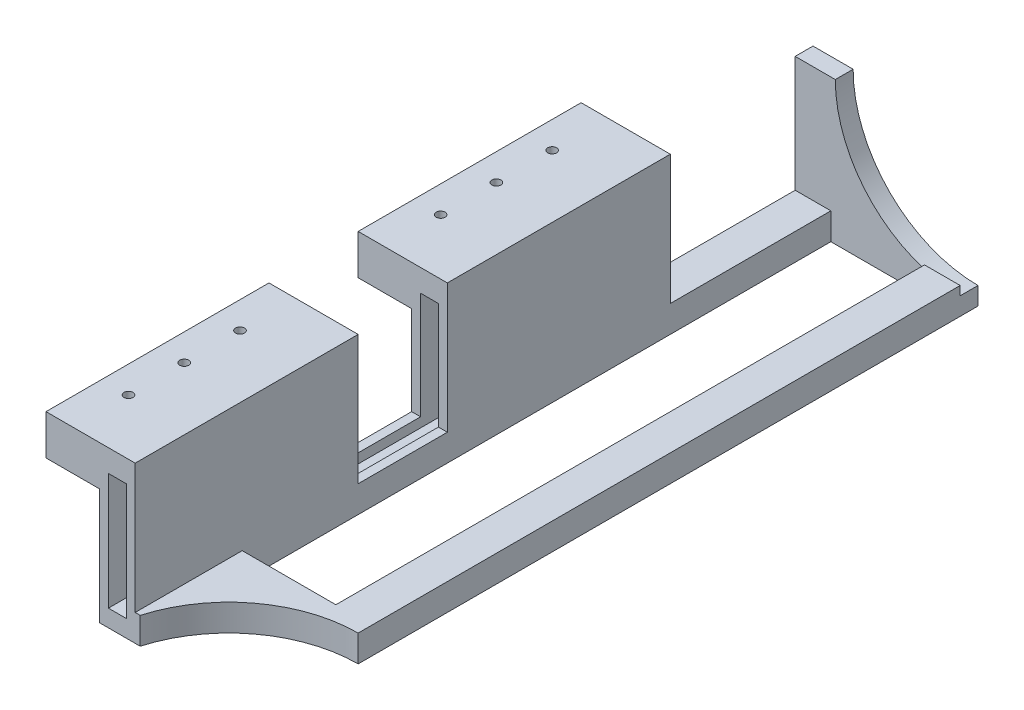
from build123d import *

# Parameters (mm, degrees)
SALIENTE_EXTRUIR1_DEPTH = 82
CROQUIS3_W              = 10
CROQUIS3_H              = 25
SALIENTE_EXTRUIR2_DEPTH = 1.5
CROQUIS4_W              = 18.5
CROQUIS4_H              = 16
SALIENTE_EXTRUIR3_DEPTH = 2
CROQUIS5_R              = 14.5
CORTAR_EXTRUIR1_DEPTH   = 10
CROQUIS9_R              = 0.5
CORTAR_EXTRUIR5_DEPTH   = 10
CORTAR_EXTRUIR6_DEPTH   = 2
CROQUIS11_W             = 10
CROQUIS11_H             = 13
CROQUIS11_W_2           = 18
CROQUIS11_W_3           = 8.121089167
CROQUIS11_H_2           = 20.058238939
CORTAR_EXTRUIR7_DEPTH   = 10
CROQUIS12_W             = 2
CROQUIS12_H             = 13.081043671
CORTAR_EXTRUIR8_DEPTH   = 60
CROQUIS13_W             = 10.5
CROQUIS13_H             = 66
CORTAR_EXTRUIR9_DEPTH   = 12
CROQUIS14_W             = 6
CROQUIS14_H             = 25
SALIENTE_EXTRUIR4_DEPTH = 3
CROQUIS15_R             = 0.5
CORTAR_EXTRUIR10_DEPTH  = 81.950919234


with BuildPart() as part:
    # Croquis2 → Saliente-Extruir1 (new body)
    with BuildSketch(Plane.XY):
        Polygon((-4.596277774, 11.502403514), (-4.596277774, -1.497596486), (9.903722226, -1.497596486), (9.903722226, -4.497596486), (-4.596277774, -4.497596486), (-8.596277774, -4.497596486), (-8.596277774, 11.502403514), align=None)
    extrude(amount=SALIENTE_EXTRUIR1_DEPTH)

    # Croquis3 → Saliente-Extruir2 (add)
    with BuildSketch(Plane(origin=(0, 11.502403514, 0), x_dir=(1, 0, 0), z_dir=(0, 1, 0))):
        with Locations((-9.596277774, -30.5)):
            Rectangle(CROQUIS3_W, CROQUIS3_H)
        with Locations((-9.596277774, -65.5)):
            Rectangle(CROQUIS3_W, CROQUIS3_H)
    extrude(amount=SALIENTE_EXTRUIR2_DEPTH)

    # Croquis4 → Saliente-Extruir3 (add)
    with BuildSketch(Plane(origin=(0, 0, 0), x_dir=(-1, 0, 0), z_dir=(0, 0, -1))):
        with Locations((-0.653722226, 3.502403514)):
            Rectangle(CROQUIS4_W, CROQUIS4_H)
    extrude(amount=SALIENTE_EXTRUIR3_DEPTH)

    # Croquis5 → Cortar-Extruir1 (cut)
    with BuildSketch(Plane(origin=(0, -1.497596486, 0), x_dir=(1, 0, 0), z_dir=(0, 1, 0))):
        with Locations((9.903722226, -82)):
            Circle(CROQUIS5_R)
    extrude(amount=-CORTAR_EXTRUIR1_DEPTH, mode=Mode.SUBTRACT)

    # Croquis9 → Cortar-Extruir5 (cut)
    with BuildSketch(Plane.XZ.offset(-11.502403514)):
        with Locations(Location((-11.596277774, 65.5, 0), (0, 0, 270))):
            Circle(CROQUIS9_R)
        with Locations(Location((-11.596277774, 59.25, 0), (0, 0, 270))):
            Circle(CROQUIS9_R)
        with Locations(Location((-11.596277774, 71.75, 0), (0, 0, 270))):
            Circle(CROQUIS9_R)
    cortar_extruir5 = extrude(amount=-CORTAR_EXTRUIR5_DEPTH, mode=Mode.SUBTRACT)

    # Simetría1: Cortar-Extruir5 across plane
    add(cortar_extruir5.mirror(Plane(origin=(0, 0, 48), x_dir=(1, 0, 0), z_dir=(0, 0, -1))), mode=Mode.SUBTRACT)

    # Croquis10 → Cortar-Extruir6 (cut)
    with BuildSketch(Plane(origin=(0, 0, -2), x_dir=(-1, 0, 0), z_dir=(0, 0, -1))):
        with BuildLine():
            Line((-9.903722226, -2.497596486), (-9.903722226, 11.502403514))
            Line((-9.903722226, 11.502403514), (4.096277774, 11.502403514))
            ThreePointArc((4.096277774, 11.502403514), (-0.00422729, 1.602908577), (-9.903722226, -2.497596486))
        make_face()
    extrude(amount=-CORTAR_EXTRUIR6_DEPTH, mode=Mode.SUBTRACT)

    # Croquis11 → Cortar-Extruir7 (cut)
    with BuildSketch(Plane.ZY.offset(8.596277774)):
        with Locations((48, 5.002403514)):
            Rectangle(CROQUIS11_W, CROQUIS11_H)
        with Locations((9, 5.002403514)):
            Rectangle(CROQUIS11_W_2, CROQUIS11_H)
        with Locations((82.060544584, 1.473284045)):
            Rectangle(CROQUIS11_W_3, CROQUIS11_H_2)
    extrude(amount=-CORTAR_EXTRUIR7_DEPTH, mode=Mode.SUBTRACT)

    # Croquis12 → Cortar-Extruir8 (cut)
    with BuildSketch(Plane.XY.offset(78)):
        with Locations((-6.596277774, 3.961881679)):
            Rectangle(CROQUIS12_W, CROQUIS12_H)
    extrude(amount=-CORTAR_EXTRUIR8_DEPTH, mode=Mode.SUBTRACT)

    # Croquis13 → Cortar-Extruir9 (cut)
    with BuildSketch(Plane.XZ.offset(4.497596486)):
        with Locations((0.653722226, 33)):
            Rectangle(CROQUIS13_W, CROQUIS13_H)
    extrude(amount=-CORTAR_EXTRUIR9_DEPTH, mode=Mode.SUBTRACT)

    # Croquis14 → Saliente-Extruir4 (add)
    with BuildSketch(Plane.XZ.offset(-11.502403514)):
        with Locations((-11.596277774, 65.5)):
            Rectangle(CROQUIS14_W, CROQUIS14_H)
        with Locations((-11.596277774, 30.5)):
            Rectangle(CROQUIS14_W, CROQUIS14_H)
    extrude(amount=SALIENTE_EXTRUIR4_DEPTH)

    # Croquis15 → Cortar-Extruir10 (cut, through all)
    with BuildSketch(Plane(origin=(0, 11.502403514, 0), x_dir=(1, 0, 0), z_dir=(0, 1, 0))):
        with Locations(Location((-11.596277774, -24.25, 0), (0, 0, 90))):
            Circle(CROQUIS15_R)
        with Locations(Location((-11.596277774, -30.5, 0), (0, 0, 90))):
            Circle(CROQUIS15_R)
        with Locations(Location((-11.596277774, -36.75, 0), (0, 0, 90))):
            Circle(CROQUIS15_R)
        with Locations(Location((-11.596277774, -65.5, 0), (0, 0, 270))):
            Circle(CROQUIS15_R)
        with Locations(Location((-11.596277774, -59.25, 0), (0, 0, 270))):
            Circle(CROQUIS15_R)
        with Locations(Location((-11.596277774, -71.75, 0), (0, 0, 270))):
            Circle(CROQUIS15_R)
    extrude(amount=-CORTAR_EXTRUIR10_DEPTH, mode=Mode.SUBTRACT)


solid = part.part
